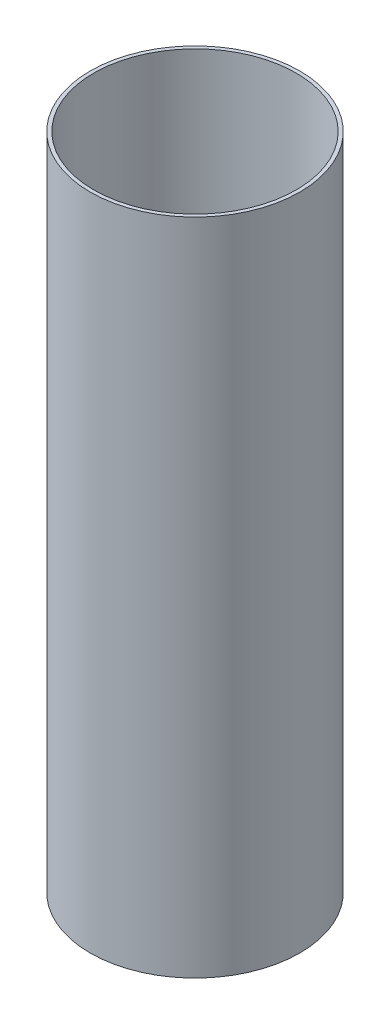
from build123d import *

# Parameters (mm, degrees)
SKETCH1_R           = 17.5
SKETCH1_R_2         = 16.9
BOSS_EXTRUDE1_DEPTH = 55


with BuildPart() as part:
    # Sketch1 → Boss-Extrude1 (new, symmetric)
    with BuildSketch(Plane(origin=(0, 0, 0), x_dir=(1, 0, 0), z_dir=(0, 1, 0))):
        with Locations(Location((0, 0, 0), (0, 0, 270))):
            Circle(SKETCH1_R)
        with Locations(Location((0, 0, 0), (0, 0, 270))):
            Circle(SKETCH1_R_2, mode=Mode.SUBTRACT)
    extrude(amount=BOSS_EXTRUDE1_DEPTH, both=True)


solid = part.part
